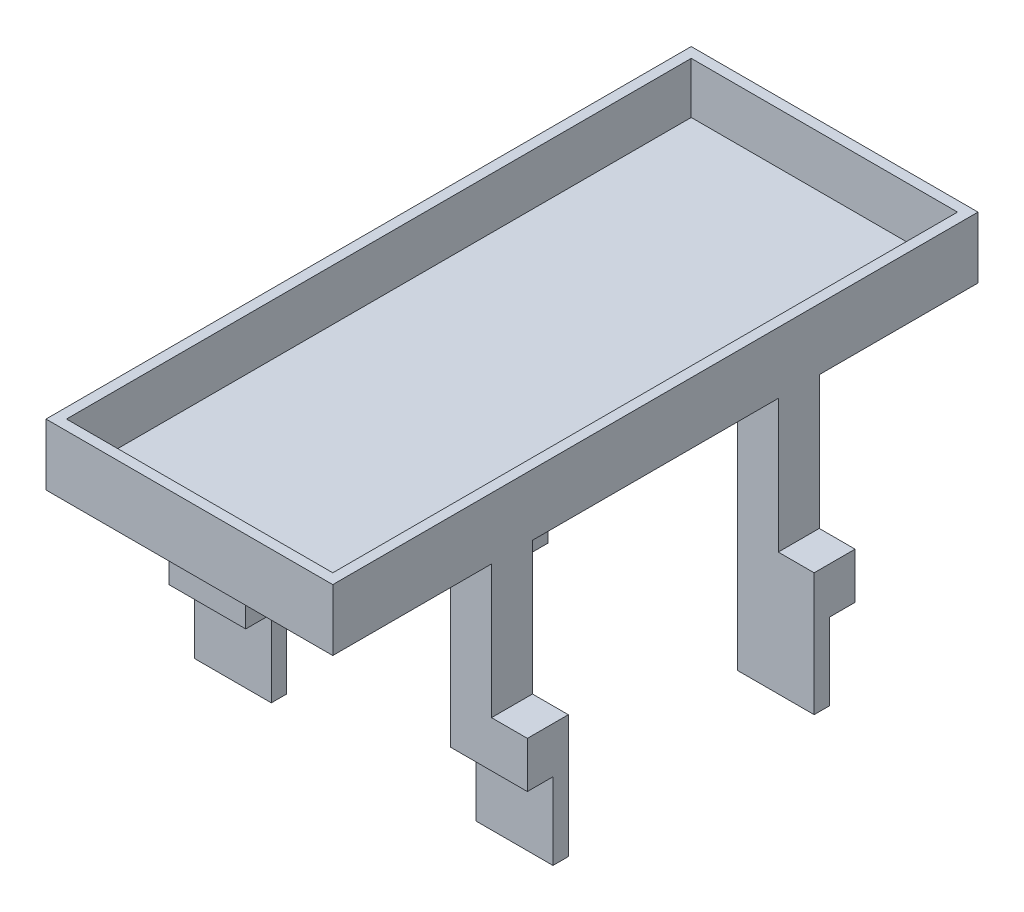
from build123d import *

# Parameters (mm, degrees)
BOSS_EXTRUDE1_DEPTH     = 35
BOSS_EXTRUDE1_2_DEPTH   = 35
SKETCH4_W               = 56
SKETCH4_H               = 126
BOSS_EXTRUDE2_DEPTH     = 12
SKETCH5_W               = 52
SKETCH5_H               = 122
CUT_EXTRUDE1_DEPTH      = 10
CUT_EXTRUDE2_DEPTH      = 113.915897906
CUT_EXTRUDE2_DEPTH_BACK = 113.915897906
SKETCH6_W               = 40
SKETCH6_H               = 50
SKETCH6_W_2             = 7
SKETCH6_H_2             = 26


with BuildPart() as part:
    # Sketch3 → Boss-Extrude1 (new, symmetric)
    with BuildSketch(Plane(origin=(0, 0, 0), x_dir=(0, 0, -1), z_dir=(1, 0, 0))):
        Polygon((24, 0), (24, -50), (27, -50), (27, -35), (32, -35), (32, 0), align=None)
    extrude(amount=BOSS_EXTRUDE1_DEPTH, both=True)



with BuildPart() as body_2:
    # Sketch3 → Boss-Extrude1 2 (new, symmetric)
    with BuildSketch(Plane(origin=(0, 0, 0), x_dir=(0, 0, -1), z_dir=(1, 0, 0))):
        Polygon((-32, 0), (-24, 0), (-24, -50), (-27, -50), (-27, -35), (-32, -35), align=None)
    extrude(amount=BOSS_EXTRUDE1_2_DEPTH, both=True)


with BuildPart() as part_1:
    add(part.part)

    add(body_2.part)  # Boss-Extrude2 merges body 2
    # Sketch4 → Boss-Extrude2 (add)
    with BuildSketch(Plane(origin=(0, 0, 0), x_dir=(1, 0, 0), z_dir=(0, 1, 0))):
        Rectangle(SKETCH4_W, SKETCH4_H)
    extrude(amount=BOSS_EXTRUDE2_DEPTH)

    # Sketch5 → Cut-Extrude1 (cut)
    with BuildSketch(Plane(origin=(0, 12, 0), x_dir=(1, 0, 0), z_dir=(0, 1, 0))):
        Rectangle(SKETCH5_W, SKETCH5_H)
    extrude(amount=-CUT_EXTRUDE1_DEPTH, mode=Mode.SUBTRACT)

    # Sketch6 → Cut-Extrude2 (cut, two sides: drawn at the far end of the back side and taken through both)
    with BuildSketch(Plane.XY.offset(32).offset(-CUT_EXTRUDE2_DEPTH_BACK)):
        with Locations((0, -25)):
            Rectangle(SKETCH6_W, SKETCH6_H)
        with Locations((-31.5, -13)):
            Rectangle(SKETCH6_W_2, SKETCH6_H_2)
        with Locations((31.5, -13)):
            Rectangle(SKETCH6_W_2, SKETCH6_H_2)
    extrude(amount=CUT_EXTRUDE2_DEPTH + CUT_EXTRUDE2_DEPTH_BACK, mode=Mode.SUBTRACT)


solid = part_1.part
